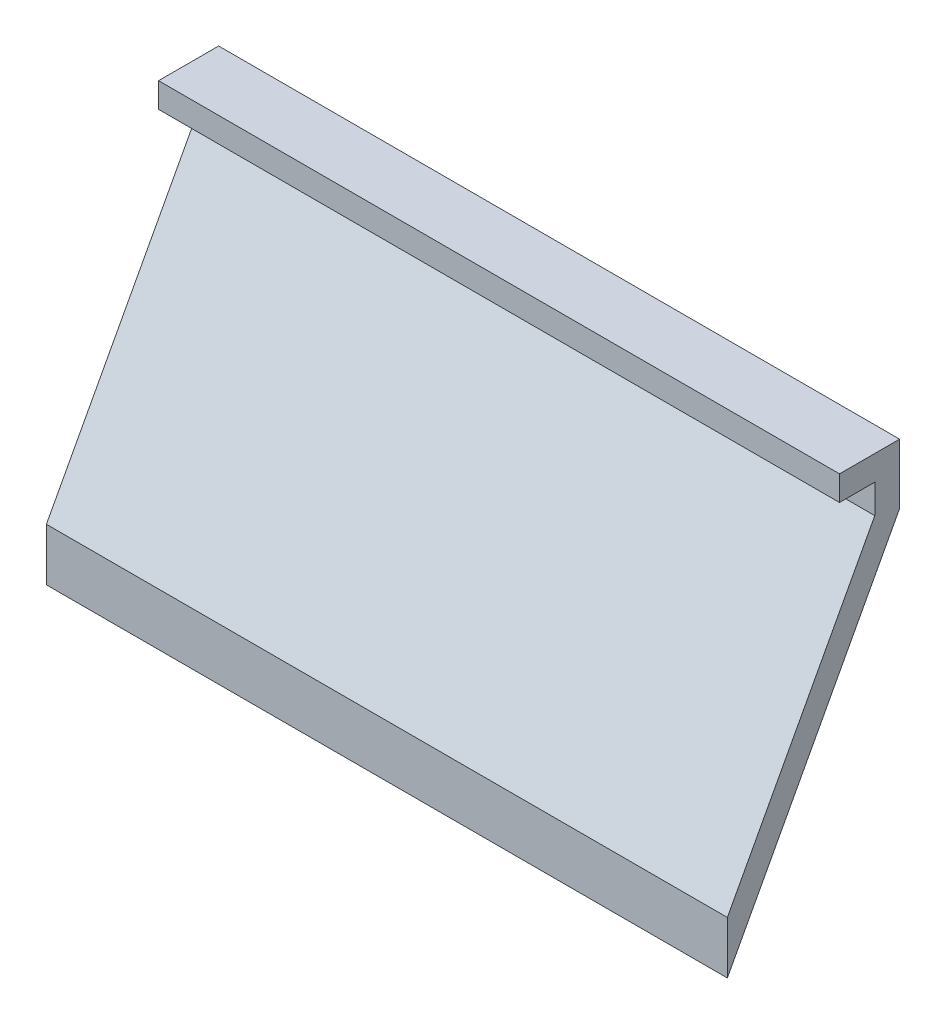
from build123d import *

# Parameters (mm, degrees)
BOSS_EXTRUDE1_DEPTH = 85


with BuildPart() as part:
    # Sketch1 → Boss-Extrude1 (new, symmetric)
    with BuildSketch(Plane(origin=(0, 0, 0), x_dir=(0, 0, -1), z_dir=(1, 0, 0))):
        Polygon((21.5, 55), (21.5, 40), (-21.5, -40), (-21.5, -26.904445699), (15.3, 41.56067058), (15.3, 48.8), (6.5, 48.8), (6.5, 55), align=None)
    extrude(amount=BOSS_EXTRUDE1_DEPTH, both=True)


solid = part.part
